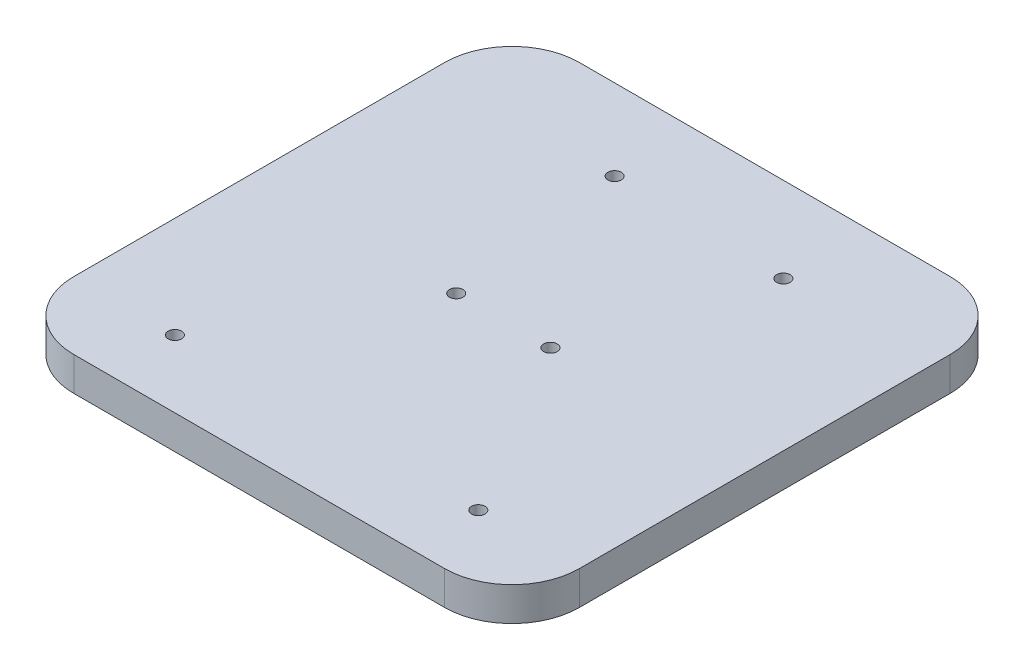
from build123d import *

# Parameters (mm, degrees)
SKETCH1_W           = 150
SKETCH1_H           = 150
SKETCH1_R           = 2
BOSS_EXTRUDE1_DEPTH = 10
SKETCH2_R           = 4
CUT_EXTRUDE1_DEPTH  = 5
FILLET1_R           = 20


with BuildPart() as part:
    # Sketch1 → Boss-Extrude1 (new body)
    with BuildSketch(Plane(origin=(0, 0, 0), x_dir=(1, 0, 0), z_dir=(0, 1, 0))):
        with Locations((75, 75)):
            Rectangle(SKETCH1_W, SKETCH1_H)
        with Locations(Location((30, 20, 0), (0, 0, 270))):
            Circle(SKETCH1_R, mode=Mode.SUBTRACT)
        with Locations(Location((120, 20, 0), (0, 0, 270))):
            Circle(SKETCH1_R, mode=Mode.SUBTRACT)
        with Locations(Location((61.03, 72.42, 0), (0, 0, 270))):
            Circle(SKETCH1_R, mode=Mode.SUBTRACT)
        with Locations(Location((88.97, 72.42, 0), (0, 0, 270))):
            Circle(SKETCH1_R, mode=Mode.SUBTRACT)
        with Locations(Location((105.74, 124.76, 0), (0, 0, 270))):
            Circle(SKETCH1_R, mode=Mode.SUBTRACT)
        with Locations(Location((54.4, 126.03, 0), (0, 0, 270))):
            Circle(SKETCH1_R, mode=Mode.SUBTRACT)
    extrude(amount=BOSS_EXTRUDE1_DEPTH)

    # Sketch2 → Cut-Extrude1 (cut)
    with BuildSketch(Plane.XZ):
        with Locations(Location((30, -20, 0), (0, 0, 270))):
            Circle(SKETCH2_R)
        with Locations(Location((120, -20, 0), (0, 0, 270))):
            Circle(SKETCH2_R)
        with Locations(Location((88.97, -72.42, 0), (0, 0, 270))):
            Circle(SKETCH2_R)
        with Locations(Location((61.03, -72.42, 0), (0, 0, 270))):
            Circle(SKETCH2_R)
        with Locations(Location((54.4, -126.03, 0), (0, 0, 270))):
            Circle(SKETCH2_R)
        with Locations(Location((105.74, -124.76, 0), (0, 0, 270))):
            Circle(SKETCH2_R)
    extrude(amount=-CUT_EXTRUDE1_DEPTH, mode=Mode.SUBTRACT)

    # Fillet1
    fillet1_edges = [part.edges().sort_by_distance(p)[0] for p in [
        (0, 5, -150),
        (150, 5, -150),
        (150, 5, 0),
        (0, 5, 0),
    ]]
    fillet(fillet1_edges, radius=FILLET1_R)


solid = part.part
